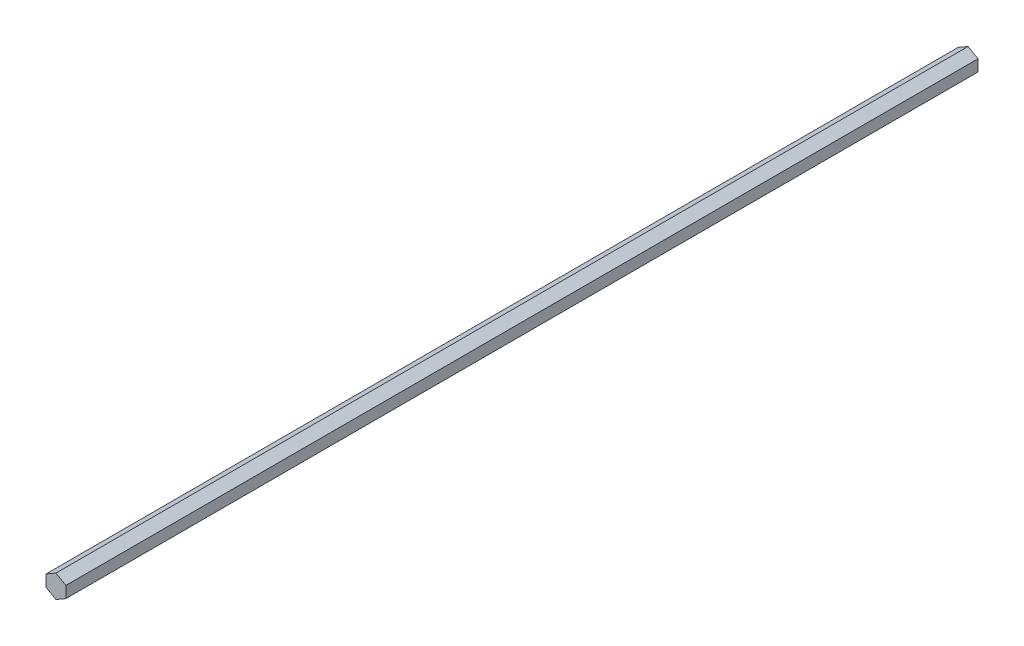
from build123d import *

# Parameters (mm, degrees)
BOSS_EXTRUDE1_DEPTH = 292.1


with BuildPart() as part:
    # Sketch1 → Boss-Extrude1 (new, symmetric)
    with BuildSketch(Plane.XY):
        Polygon((6.35, 3.666174209), (0, 7.332348419), (-6.35, 3.666174209), (-6.35, -3.666174209), (0, -7.332348419), (6.35, -3.666174209), align=None)
    extrude(amount=BOSS_EXTRUDE1_DEPTH, both=True)


solid = part.part
